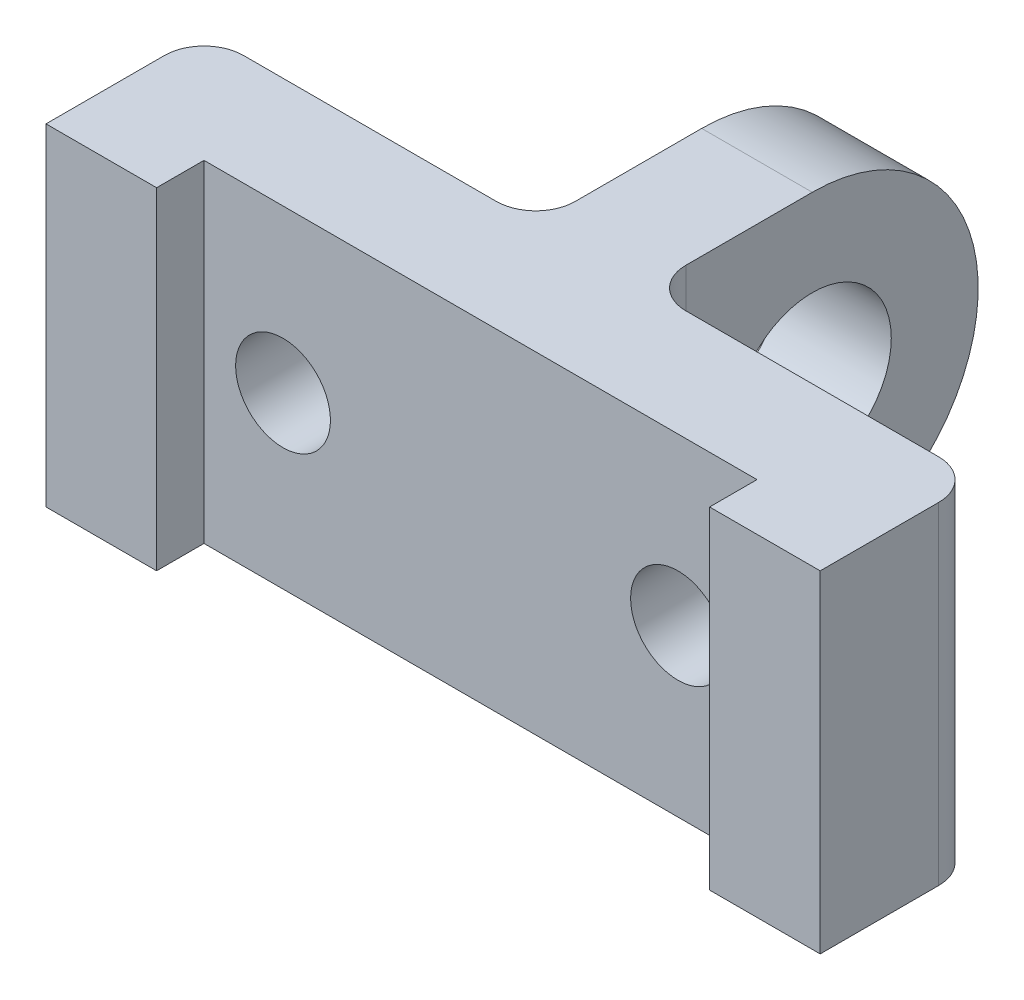
from build123d import *

# Parameters (mm, degrees)
SKETCH1_W           = 98
SKETCH1_H           = 42
BOSS_EXTRUDE1_DEPTH = 14
SKETCH3_R           = 6
CUT_EXTRUDE1_DEPTH  = 31
SKETCH3_3_R         = 6
CUT_EXTRUDE2_DEPTH  = 150
FILLET1_R           = 5
SKETCH4_W           = 14
SKETCH4_H           = 42
BOSS_EXTRUDE2_DEPTH = 6
FILLET2_R           = 5
SKETCH5_W           = 14
SKETCH5_H           = 42
BOSS_EXTRUDE3_DEPTH = 6
SKETCH6_W           = 42
SKETCH6_H           = 42
BOSS_EXTRUDE4_DEPTH = 7
FILLET4_RADIUS      = 21
FILLET4_LENGTH      = 14
SKETCH7_R           = 10
CUT_EXTRUDE3_DEPTH  = 20.5
FILLET5_R           = 5


with BuildPart() as part:
    # Sketch1 → Boss-Extrude1 (new body)
    with BuildSketch(Plane.XY):
        Rectangle(SKETCH1_W, SKETCH1_H)
    extrude(amount=BOSS_EXTRUDE1_DEPTH)

    # Sketch3 → Cut-Extrude1 (cut)
    with BuildSketch(Plane.XY):
        with Locations(Location((25, 0, 0), (0, 0, 180))):
            Circle(SKETCH3_R)
    extrude(amount=CUT_EXTRUDE1_DEPTH, mode=Mode.SUBTRACT)

    # Sketch3<3> → Cut-Extrude2 (cut)
    with BuildSketch(Plane.XY):
        with Locations(Location((-25, 0.49893218, 0), (0, 0, 180))):
            Circle(SKETCH3_3_R)
        with Locations(Location((25, 0, 0), (0, 0, 180))):
            Circle(SKETCH3_3_R)
    extrude(amount=CUT_EXTRUDE2_DEPTH, mode=Mode.SUBTRACT)

    # Fillet1
    fillet1_edges = [part.edges().sort_by_distance(p)[0] for p in [
        (-49, 0, 0),
    ]]
    fillet(fillet1_edges, radius=FILLET1_R)

    # Sketch4 → Boss-Extrude2 (add)
    with BuildSketch(Plane.XY.offset(14)):
        with Locations((-42, 0)):
            Rectangle(SKETCH4_W, SKETCH4_H)
    extrude(amount=BOSS_EXTRUDE2_DEPTH)

    # Fillet2
    fillet2_edges = [part.edges().sort_by_distance(p)[0] for p in [
        (49, 0, 0),
    ]]
    fillet(fillet2_edges, radius=FILLET2_R)

    # Sketch5 → Boss-Extrude3 (add)
    with BuildSketch(Plane.XY.offset(14)):
        with Locations((42, 0)):
            Rectangle(SKETCH5_W, SKETCH5_H)
    extrude(amount=BOSS_EXTRUDE3_DEPTH)

    # Sketch6 → Boss-Extrude4 (add, symmetric)
    with BuildSketch(Plane(origin=(0, 0, 0), x_dir=(0, 0, -1), z_dir=(1, 0, 0))):
        with Locations((21, 0)):
            Rectangle(SKETCH6_W, SKETCH6_H)
    extrude(amount=BOSS_EXTRUDE4_DEPTH, both=True)

    # Fillet4: full round fillet: the end face becomes a half cylinder, R = half its width
    fillet4_face = Plane((0, 0, -42), x_dir=(-1, 0, 0), z_dir=(0, 0, -1))  # on the end face: x along it, z out of the body
    fillet4_slab = fillet4_face.offset(-FILLET4_RADIUS / 2) * Box(FILLET4_LENGTH, 2 * FILLET4_RADIUS, FILLET4_RADIUS, mode=Mode.PRIVATE)  # the body's end, R deep
    fillet4_round = Plane((0, 0, -21), x_dir=(0, 0, -1), z_dir=(-1, 0, 0)) * Cylinder(FILLET4_RADIUS, FILLET4_LENGTH, mode=Mode.PRIVATE)  # its axis R under the face
    add(fillet4_slab - fillet4_round, mode=Mode.SUBTRACT)

    # Sketch7 → Cut-Extrude3 (cut, symmetric)
    with BuildSketch(Plane(origin=(0, 0, 0), x_dir=(0, 0, -1), z_dir=(1, 0, 0))):
        with Locations((21, 0)):
            Circle(SKETCH7_R)
    extrude(amount=CUT_EXTRUDE3_DEPTH, both=True, mode=Mode.SUBTRACT)

    # Fillet5
    fillet5_edges = [part.edges().sort_by_distance(p)[0] for p in [
        (-7, 0, 0),
        (7, 0, 0),
    ]]
    fillet(fillet5_edges, radius=FILLET5_R)


solid = part.part
